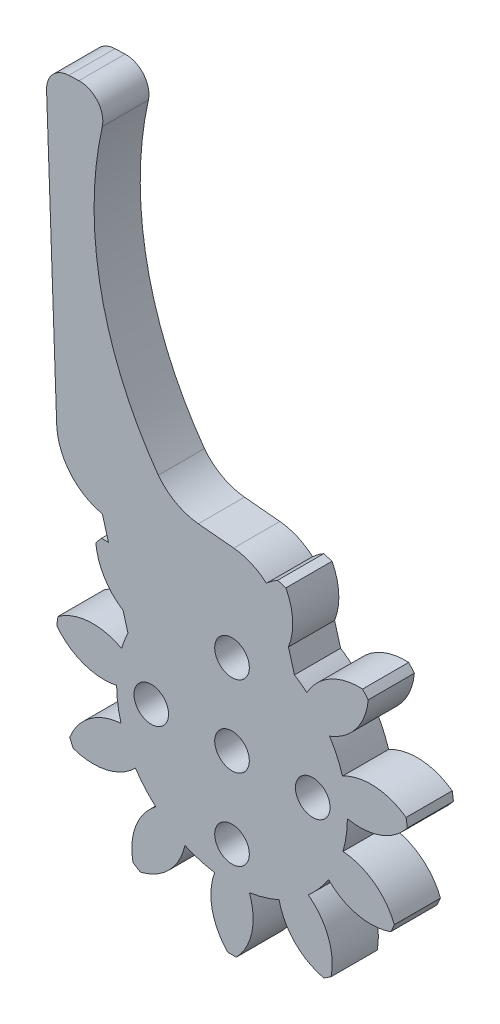
from build123d import *

# Parameters (mm, degrees)
SKETCH_1_R          = 1.5
EXTRUDE_1_DEPTH     = 4
EXTRUDE_START       = -4
SKETCH_2_R          = 1.5
EXTRUDE_2_DEPTH     = 4
SKETCH_3_R          = 1.5
CUT_EXTRUDE_1_DEPTH = 10


with BuildPart() as part:
    # Эскиз1 → Бобышка-Вытянуть1 (new body)
    with BuildSketch(Plane.XY):
        with BuildLine():
            ThreePointArc((14.071260881, -6.013492872), (12.319653053, -3.733490841), (9.621977893, -2.738961818))
            ThreePointArc((9.621977893, -2.738961818), (9.902389121, -1.423748614), (10.003874897, -0.082809815))
            ThreePointArc((10.003874897, -0.082809815), (12.872466462, 0.111410875), (15.195472667, 1.805571852))
            ThreePointArc((15.195472667, 1.805571852), (15.146612375, 2.177754087), (15.088637629, 2.548625862))
            ThreePointArc((15.088637629, 2.548625862), (12.382429194, 3.519694937), (9.575317452, 2.897872688))
            ThreePointArc((9.575317452, 2.897872688), (9.100156446, 4.155902197), (8.460565465, 5.338839053))
            ThreePointArc((8.460565465, 5.338839053), (10.768774621, 7.053105583), (11.807079223, 9.734236463))
            ThreePointArc((11.807079223, 9.734236463), (11.564758421, 10.020920215), (11.315478542, 10.301573893))
            ThreePointArc((11.315478542, 10.301573893), (8.513871556, 9.655402442), (6.488561375, 7.614653091))
            ThreePointArc((6.488561375, 7.614653091), (5.408688398, 8.416083426), (4.231086277, 9.065444244))
            ThreePointArc((4.231086277, 9.065444244), (5.246072926, 11.755489103), (4.67002155, 14.572349777))
            ThreePointArc((4.67002155, 14.572349777), (4.311175381, 14.68251498), (3.949734969, 14.783845))
            ThreePointArc((3.949734969, 14.783845), (1.942219856, 12.725587893), (1.341732908, 9.91383494))
            ThreePointArc((1.341732908, 9.91383494), (0, 10.004217632), (-1.341732908, 9.91383494))
            ThreePointArc((-1.341732908, 9.91383494), (-1.942219856, 12.725587893), (-3.949734969, 14.783845))
            ThreePointArc((-3.949734969, 14.783845), (-4.311175381, 14.68251498), (-4.67002155, 14.572349777))
            ThreePointArc((-4.67002155, 14.572349777), (-5.246072926, 11.755489103), (-4.231086277, 9.065444244))
            ThreePointArc((-4.231086277, 9.065444244), (-5.408688398, 8.416083426), (-6.488561375, 7.614653091))
            ThreePointArc((-6.488561375, 7.614653091), (-8.513871556, 9.655402442), (-11.315478542, 10.301573893))
            ThreePointArc((-11.315478542, 10.301573893), (-11.564758421, 10.020920215), (-11.807079223, 9.734236463))
            ThreePointArc((-11.807079223, 9.734236463), (-10.768774621, 7.053105583), (-8.460565465, 5.338839053))
            ThreePointArc((-8.460565465, 5.338839053), (-9.100156446, 4.155902197), (-9.575317452, 2.897872688))
            ThreePointArc((-9.575317452, 2.897872688), (-12.382429194, 3.519694937), (-15.088637629, 2.548625862))
            ThreePointArc((-15.088637629, 2.548625862), (-15.146612375, 2.177754087), (-15.195472667, 1.805571852))
            ThreePointArc((-15.195472667, 1.805571852), (-12.872466462, 0.111410875), (-10.003874897, -0.082809815))
            ThreePointArc((-10.003874897, -0.082809815), (-9.902389121, -1.423748614), (-9.621977893, -2.738961818))
            ThreePointArc((-9.621977893, -2.738961818), (-12.319653053, -3.733490841), (-14.071260881, -6.013492872))
            ThreePointArc((-14.071260881, -6.013492872), (-13.91952392, -6.356833577), (-13.759410906, -6.696349066))
            ThreePointArc((-13.759410906, -6.696349066), (-10.889241154, -6.865655999), (-8.371024733, -5.478167151))
            ThreePointArc((-8.371024733, -5.478167151), (-7.560683217, -6.551369301), (-6.613728339, -7.506195299))
            ThreePointArc((-6.613728339, -7.506195299), (-8.345474114, -9.801319657), (-8.586358225, -12.666370108))
            ThreePointArc((-8.586358225, -12.666370108), (-8.273084972, -12.873171495), (-7.954833402, -13.072226469))
            ThreePointArc((-7.954833402, -13.072226469), (-5.448758719, -11.662925603), (-4.080433364, -9.134245124))
            ThreePointArc((-4.080433364, -9.134245124), (-2.818513813, -9.598976524), (-1.505666768, -9.89026481))
            ThreePointArc((-1.505666768, -9.89026481), (-1.72166611, -12.757298735), (-0.375347502, -15.297764332))
            ThreePointArc((-0.375347502, -15.297764332), (0, -15.302368421), (0.375347502, -15.297764332))
            ThreePointArc((0.375347502, -15.297764332), (1.72166611, -12.757298735), (1.505666768, -9.89026481))
            ThreePointArc((1.505666768, -9.89026481), (2.818513813, -9.598976524), (4.080433364, -9.134245124))
            ThreePointArc((4.080433364, -9.134245124), (5.448758719, -11.662925603), (7.954833402, -13.072226469))
            ThreePointArc((7.954833402, -13.072226469), (8.273084972, -12.873171495), (8.586358225, -12.666370108))
            ThreePointArc((8.586358225, -12.666370108), (8.345474114, -9.801319657), (6.613728339, -7.506195299))
            ThreePointArc((6.613728339, -7.506195299), (7.560683217, -6.551369301), (8.371024733, -5.478167151))
            ThreePointArc((8.371024733, -5.478167151), (10.889241154, -6.865655999), (13.759410906, -6.696349066))
            ThreePointArc((13.759410906, -6.696349066), (13.91952392, -6.356833577), (14.071260881, -6.013492872))
        make_face()
        Circle(SKETCH_1_R, mode=Mode.SUBTRACT)
    extrude(amount=EXTRUDE_1_DEPTH)

    # Эскиз2 → Бобышка-Вытянуть2 (add)
    with BuildSketch(Plane.XY.offset(4).offset(EXTRUDE_START)):
        with BuildLine():
            Line((-13.27175932, 43.680693777), (-14.149597226, 43.649446698))
            ThreePointArc((-14.149597226, 43.649446698), (-15.542077543, 43.013723237), (-16.077185448, 41.579566593))
            Line((-16.077185448, 41.579566593), (-15.198219126, 16.886379902))
            ThreePointArc((-15.198219126, 16.886379902), (-14.029929813, 13.848310241), (-11.239138319, 12.173123678))
            Line((-11.239138319, 12.173123678), (-7.216634951, -2.042101853))
            ThreePointArc((-7.216634951, -2.042101853), (2.042101853, -7.216634951), (7.216634951, 2.042101853))
            Line((7.216634951, 2.042101853), (4.487820228, 11.685528641))
            ThreePointArc((4.487820228, 11.685528641), (2.878536468, 14.16449679), (0.150531719, 15.301628001))
            Line((0.150531719, 15.301628001), (-2.91779922, 15.593698218))
            ThreePointArc((-2.91779922, 15.593698218), (-4.851213091, 16.18881198), (-6.390589925, 17.501278571))
            ThreePointArc((-6.390589925, 17.501278571), (-11.35627908, 28.85521173), (-11.248467313, 41.247073721))
            ThreePointArc((-11.248467313, 41.247073721), (-11.662703429, 42.960565491), (-13.27175932, 43.680693777))
        make_face()
        Circle(SKETCH_2_R, mode=Mode.SUBTRACT)
    extrude(amount=EXTRUDE_2_DEPTH)

    # Эскиз3 → Вырез-Вытянуть1 (cut)
    with BuildSketch(Plane.XY.offset(4)):
        with Locations((0, 7)):
            Circle(SKETCH_3_R)
        with Locations((7, 0)):
            Circle(SKETCH_3_R)
        with Locations((0, -7)):
            Circle(SKETCH_3_R)
        with Locations((-7, 0)):
            Circle(SKETCH_3_R)
    extrude(amount=-CUT_EXTRUDE_1_DEPTH, mode=Mode.SUBTRACT)


solid = part.part
